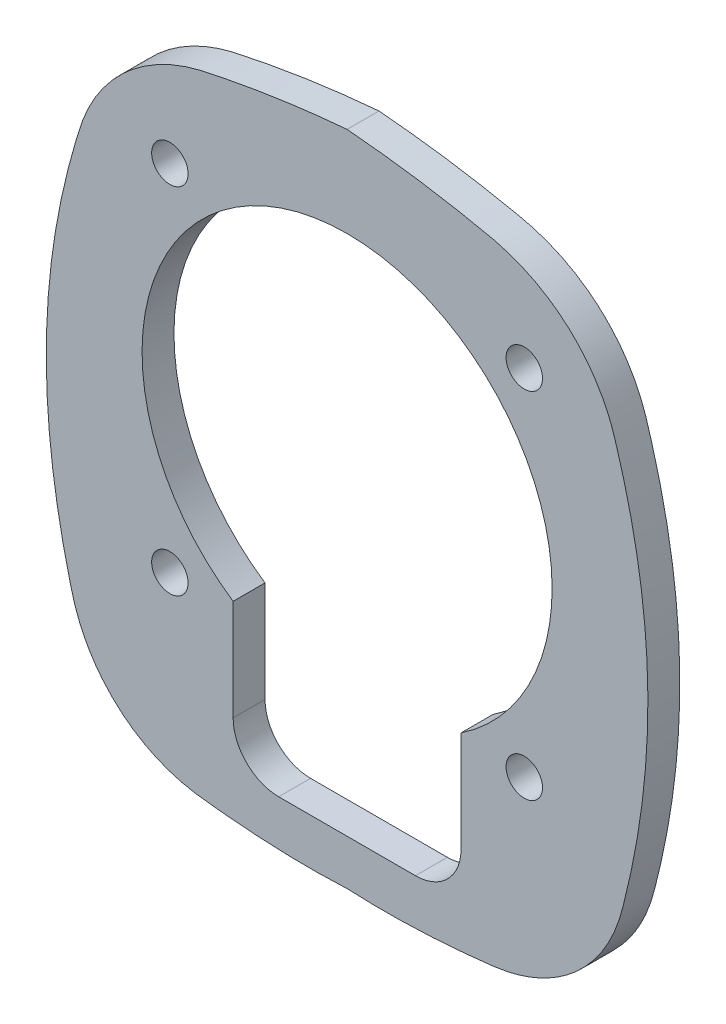
from build123d import *

# Parameters (mm, degrees)
SKETCH_1_R      = 1.6
EXTRUDE_1_DEPTH = 1.4


with BuildPart() as part:
    # Эскиз1 → Бобышка-Вытянуть1 (new, symmetric)
    with BuildSketch(Plane.XY):
        with BuildLine():
            add(Edge.make_bspline(
                [(0, 71.831470018), (0.224416179, 71.820521503), (0.684147103, 71.798092768), (1.390553246, 71.77394313), (2.129936147, 71.756509949), (3.120275382, 71.74483738), (4.340849325, 71.750217073), (6.266834443, 71.797645626), (8.216765497, 71.904490636), (10.138363938, 72.060642203), (11.317506615, 72.175559831), (12.190762764, 72.272185641), (12.805513935, 72.34273449), (13.37772465, 72.421015924), (13.905793885, 72.51624936), (14.710527508, 72.690687443), (15.800793475, 73.010372547), (17.141904851, 73.568840352), (18.417290334, 74.275623423), (19.992263936, 75.396111642), (21.361320354, 76.772642414), (22.481227657, 78.351307534), (23.068879442, 79.405660146), (23.47491154, 80.294917035), (23.729868011, 80.941501678), (23.965799926, 81.633834828), (24.153338764, 82.306879474), (24.330358453, 83.00364592), (24.498623524, 83.682852837), (24.672935215, 84.420326333), (24.894452544, 85.403785706), (25.147911089, 86.617394475), (25.514893824, 88.575319472), (25.882308723, 90.962184892), (26.300820369, 94.804193168), (26.463913272, 98.662356192), (26.342005837, 102.541634909), (26.106073622, 105.475217496), (25.739905361, 108.321403549), (25.227143621, 111.202492324), (24.589229676, 114.018264761), (24.012742476, 116.128067688), (23.594450813, 117.509879625), (23.392959669, 118.162199377), (23.144559301, 118.849290868), (22.578937407, 120.197043553), (21.395813943, 122.20366756), (19.396198372, 124.35989197), (17.580783875, 125.655403223), (16.320150391, 126.345818353), (15.599775822, 126.690785698), (14.886977613, 126.987530367), (14.185674872, 127.239235753), (13.4992906, 127.449114007), (12.830466587, 127.621163827), (12.180109738, 127.758284309), (11.275940312, 127.947686764), (10.10864648, 128.178443045), (8.671063895, 128.441470677), (7.23596598, 128.681619076), (5.794651251, 128.900345473), (4.352526893, 129.096713978), (2.909802689, 129.270791509), (1.461468081, 129.42574856), (0.491356771, 129.511830561), (0, 129.555430685)],
                knots=[0, 0, 0, 0, 0.007244605, 0.014841038, 0.022789911, 0.031091474, 0.046775107, 0.062143324, 0.093208403, 0.109725275, 0.12430576, 0.131406773, 0.138054233, 0.144257857, 0.150025241, 0.155350814, 0.170805279, 0.186580817, 0.202100267, 0.21771775, 0.248802801, 0.264074926, 0.280043131, 0.287631711, 0.295585242, 0.302443172, 0.311206798, 0.318104118, 0.32562435, 0.333768658, 0.342537986, 0.358128954, 0.37374132, 0.406765732, 0.435964931, 0.498333073, 0.531061733, 0.561065485, 0.593194037, 0.623552495, 0.655389193, 0.686254889, 0.69404876, 0.701942711, 0.708264803, 0.717598153, 0.749054081, 0.782774243, 0.811661581, 0.820522691, 0.829104834, 0.837401662, 0.84540792, 0.853120197, 0.860537068, 0.867667093, 0.874548901, 0.890324616, 0.906031654, 0.921670378, 0.937239422, 0.953035768, 0.968597359, 0.984094711, 1, 1, 1, 1], degree=3))
            add(Edge.make_bspline(
                [(0, 129.555430685), (-0.3274469, 129.526821193), (-0.97676619, 129.47008926), (-1.94136409, 129.37413494), (-3.056324136, 129.253266033), (-4.33348257, 129.099051372), (-5.930351425, 128.882090385), (-7.686739234, 128.611471892), (-9.596818382, 128.277448203), (-11.106542408, 127.982961479), (-12.225682791, 127.749046891), (-12.965665391, 127.590900371), (-13.728257741, 127.38440617), (-14.512340962, 127.12867723), (-15.313338162, 126.817150771), (-16.126082065, 126.445703171), (-17.444098211, 125.743263421), (-19.280339416, 124.458335973), (-20.897470488, 122.754065632), (-22.034433682, 121.114113169), (-22.647536356, 120.002685322), (-23.061262162, 119.056911748), (-23.290611707, 118.451294304), (-23.451372125, 117.974169765), (-23.593602687, 117.510925094), (-23.962747453, 116.29902851), (-24.520446784, 114.289265865), (-25.166074376, 111.498333257), (-25.689092368, 108.644834899), (-26.201960729, 104.828502487), (-26.499515195, 99.98054875), (-26.329237181, 95.232849809), (-25.93805017, 91.394955647), (-25.588168293, 89.015952156), (-25.230921433, 87.044071951), (-24.944100715, 85.627054403), (-24.629786889, 84.217645213), (-24.354324302, 83.095975922), (-24.148229918, 82.290039423), (-24.018866814, 81.82364516), (-23.854058531, 81.298190812), (-23.644300292, 80.71174475), (-23.261971585, 79.798161959), (-22.705487298, 78.719420483), (-21.622673835, 77.084782927), (-20.275439366, 75.645040405), (-18.70790573, 74.463273721), (-17.43352671, 73.713373036), (-16.091213811, 73.116181806), (-14.729830923, 72.683377588), (-13.290023133, 72.386934206), (-12.0157978, 72.251669974), (-10.861011854, 72.129946685), (-9.882225452, 72.040200908), (-8.690178345, 71.944054587), (-7.351893097, 71.856869551), (-5.885866144, 71.789392779), (-4.431210112, 71.751283956), (-2.93368772, 71.743598504), (-1.452459975, 71.765989714), (-0.468886907, 71.810331496), (0, 71.831470018)],
                knots=[0, 0, 0, 0, 0.010598151, 0.021015878, 0.03125472, 0.046758535, 0.062493293, 0.08321448, 0.104054482, 0.125011796, 0.132806062, 0.140920641, 0.149405541, 0.158266648, 0.167501077, 0.17710211, 0.187061294, 0.215634744, 0.248952004, 0.262142742, 0.279924845, 0.289768054, 0.295408131, 0.300800495, 0.305998819, 0.311032375, 0.341649106, 0.373225657, 0.403367609, 0.435153797, 0.497342248, 0.559715014, 0.588091433, 0.621706133, 0.63721354, 0.652703471, 0.668318924, 0.68377061, 0.689942401, 0.695141175, 0.699373983, 0.707696653, 0.715212041, 0.731297012, 0.746741468, 0.778347613, 0.79422157, 0.809930343, 0.825916928, 0.84149251, 0.855899247, 0.873234756, 0.882779729, 0.89334397, 0.904924482, 0.921339891, 0.936583372, 0.952241615, 0.96825542, 0.98486679, 1, 1, 1, 1], degree=3))
        make_face()
        with Locations((15.556349186, 119.193294207)):
            Circle(SKETCH_1_R, mode=Mode.SUBTRACT)
        with Locations((-15.559306188, 119.193294207)):
            Circle(SKETCH_1_R, mode=Mode.SUBTRACT)
        with Locations((15.556349186, 88.080595835)):
            Circle(SKETCH_1_R, mode=Mode.SUBTRACT)
        with Locations((-15.559306188, 88.080595835)):
            Circle(SKETCH_1_R, mode=Mode.SUBTRACT)
        with BuildLine():
            Line((-6.004910411, 75.812044251), (6.001953409, 75.812044251))
            ThreePointArc((6.001953409, 75.812044251), (8.830380533, 76.983617126), (10.001953409, 79.812044251))
            Line((10.001953409, 79.812044251), (10.001953409, 88.671620834))
            ThreePointArc((10.001953409, 88.671620834), (0.00177843, 121.636944933), (-10.004910411, 88.673597545))
            Line((-10.004910411, 88.673597545), (-10.004910411, 79.812044251))
            ThreePointArc((-10.004910411, 79.812044251), (-8.833337536, 76.983617126), (-6.004910411, 75.812044251))
        make_face(mode=Mode.SUBTRACT)
    extrude(amount=EXTRUDE_1_DEPTH, both=True)


solid = part.part
